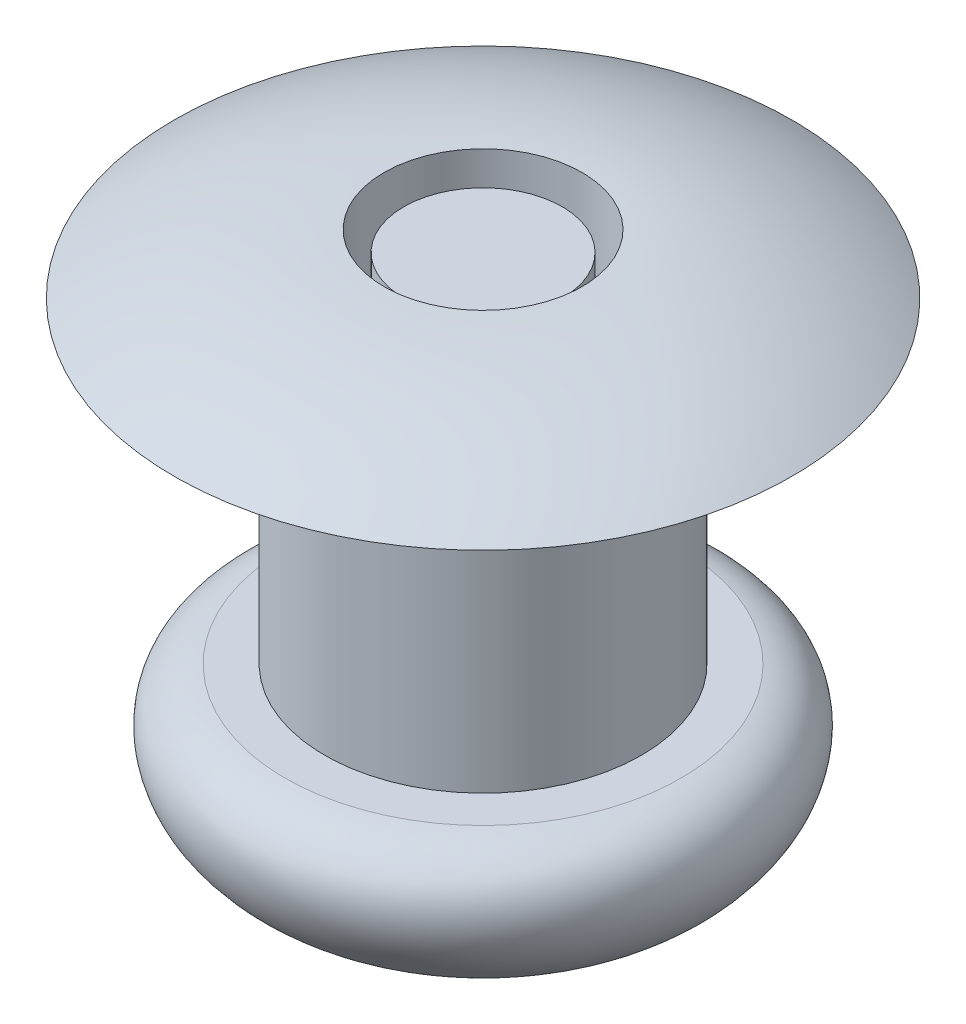
from build123d import *


with BuildPart() as part:
    # Szkic1 → Obrót1 (revolve)
    with BuildSketch(Plane.XY):
        with BuildLine():
            Line((-3.9, 0), (-2, 0))
            Line((-2, 0), (-2, -4))
            Line((-2, -4), (-2.5, -4))
            add(Edge.make_bspline(
                [(-2.5, -4), (-3.327610974, -4.147752927), (-3.254907827, -5.965433101), (-0.030071268, -6.376789975), (-1.228998971, -4.324995631), (-0.216890965, -5.491229408), (0, -5.421523045)],
                knots=[0, 0, 0, 0, 0.343812162, 0.687238794, 0.81979877, 1, 1, 1, 1], degree=3))
            Line((0, -5.421523045), (0, 0.5))
            Line((0, 0.5), (-1, 0.5))
            Line((-1, 0.5), (-1, -4))
            Line((-1, -4), (-1.25, -4))
            Line((-1.25, -4), (-1.25, 0.75))
            ThreePointArc((-1.25, 0.75), (-2.627043935, 0.558888572), (-3.9, 0))
        make_face()
    revolve(axis=Axis((0, 0.5, 0), (0, -1, 0)))


solid = part.part
